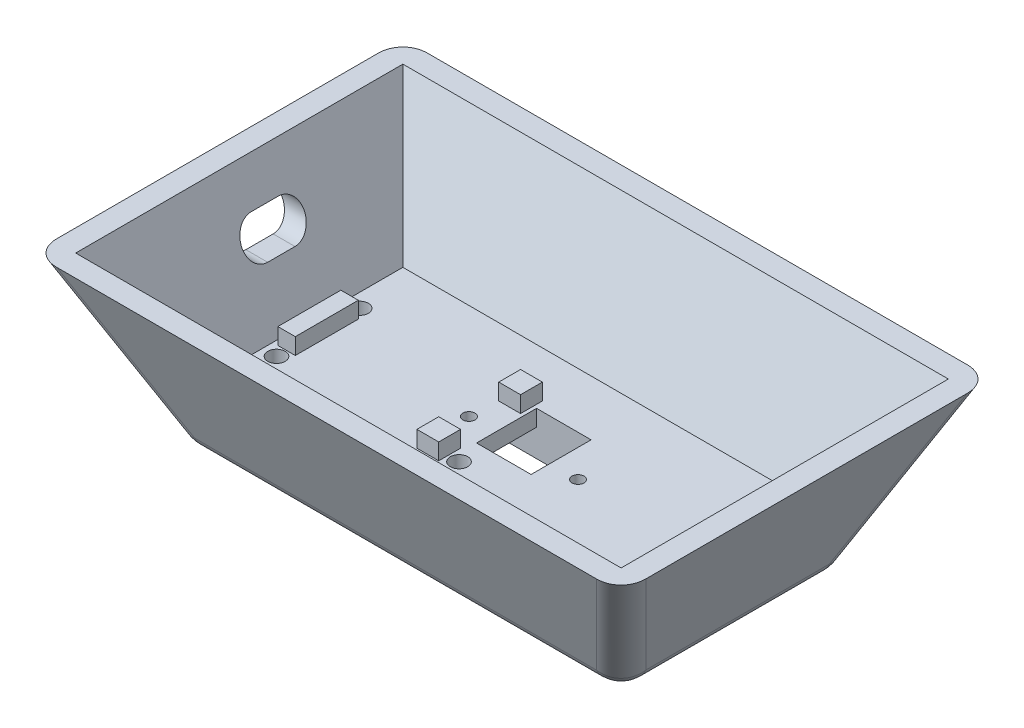
from build123d import *

# Parameters (mm, degrees)
SKETCH1_W                = 80
SKETCH1_H                = 40
BOSS_EXTRUDE1_DEPTH      = 30
BOSS_EXTRUDE1_DRAFT      = -25
SKETCH2_W                = 30.2
SKETCH2_H                = 19.2
CUT_EXTRUDE1_DEPTH       = 5
SKETCH3_W                = 99.97845949
SKETCH3_H                = 59.97845949
CUT_EXTRUDE3_DEPTH       = 22
CUT_EXTRUDE3_DRAFT       = -25
CUT_EXTRUDE4_REACH       = 70.521
SKETCH5_R                = 1.1
SKETCH5_W                = 10
SKETCH5_H                = 11
SKETCH6_R                = 1.6
PCB_HEATSETINSERTS_DEPTH = 4.75
SKETCH7_W                = 4
SKETCH7_H                = 4
SKETCH7_W_2              = 3.2
SKETCH7_H_2              = 11.55
BOSS_EXTRUDE3_DEPTH      = 3
FILLET1_R                = 5
USB_C_CUTOUT_REACH       = 102.398


with BuildPart() as part:
    # Sketch1 → Boss-Extrude1 (with draft: the straight prism first)
    with BuildSketch(Plane(origin=(0, 0, 0), x_dir=(1, 0, 0), z_dir=(0, 1, 0))):
        Rectangle(SKETCH1_W, SKETCH1_H)
    extrude(amount=BOSS_EXTRUDE1_DEPTH)
    # Boss-Extrude1: the draft: its side faces are tilted about the plane it starts from
    boss_extrude1_sides = [part.faces().sort_by_distance(p)[0] for p in [
        (-40, 15, 0),
        (0, 15, 20),
        (40, 15, 0),
        (0, 15, -20),
    ]]
    draft(boss_extrude1_sides, Plane(origin=(0, 0, 0), x_dir=(1, 0, 0), z_dir=(0, 1, 0)), BOSS_EXTRUDE1_DRAFT)

    # Sketch2 → Cut-Extrude1 (cut)
    with BuildSketch(Plane.XZ):
        Rectangle(SKETCH2_W, SKETCH2_H)
    extrude(amount=-CUT_EXTRUDE1_DEPTH, mode=Mode.SUBTRACT)


with BuildPart() as cut_extrude3_tool:
    # Sketch3 → Cut-Extrude3 (with draft: the straight prism first)
    with BuildSketch(Plane(origin=(0, 30, 0), x_dir=(1, 0, 0), z_dir=(0, 1, 0))):
        Rectangle(SKETCH3_W, SKETCH3_H)
    extrude(amount=-CUT_EXTRUDE3_DEPTH)
    # Cut-Extrude3: the draft: its side faces are tilted about the plane it starts from
    cut_extrude3_sides = [cut_extrude3_tool.faces().sort_by_distance(p)[0] for p in [
        (-49.989229745, 19, 0),
        (0, 19, 29.989229745),
        (49.989229745, 19, 0),
        (0, 19, -29.989229745),
    ]]
    draft(cut_extrude3_sides, Plane(origin=(0, 30, 0), x_dir=(1, 0, 0), z_dir=(0, 1, 0)), CUT_EXTRUDE3_DRAFT)


with BuildPart() as part_1:
    add(part.part)

    # Cut-Extrude3: cut by cut_extrude3_tool
    add(cut_extrude3_tool.part, mode=Mode.SUBTRACT)

    # Sketch5 → Cut-Extrude4 (cut, up to next)
    with BuildSketch(Plane.XZ.offset(-5), mode=Mode.PRIVATE) as cut_extrude4_sk1:
        with Locations(Location((-10, -2.1, 0), (0, 0, 270))):
            Circle(SKETCH5_R)
    cut_extrude4_tool1 = extrude(cut_extrude4_sk1.sketch, amount=-CUT_EXTRUDE4_REACH, mode=Mode.PRIVATE) & part_1.part
    # Sketch5 → Cut-Extrude4 (cut, up to next)
    with BuildSketch(Plane.XZ.offset(-5), mode=Mode.PRIVATE) as cut_extrude4_sk2:
        with Locations(Location((10, -2.1, 0), (0, 0, 270))):
            Circle(SKETCH5_R)
    cut_extrude4_tool2 = extrude(cut_extrude4_sk2.sketch, amount=-CUT_EXTRUDE4_REACH, mode=Mode.PRIVATE) & part_1.part
    # Sketch5 → Cut-Extrude4 (cut, up to next)
    with BuildSketch(Plane.XZ.offset(-5), mode=Mode.PRIVATE) as cut_extrude4_sk3:
        with Locations((-0.1, -4.1)):
            Rectangle(SKETCH5_W, SKETCH5_H)
    cut_extrude4_tool3 = extrude(cut_extrude4_sk3.sketch, amount=-CUT_EXTRUDE4_REACH, mode=Mode.PRIVATE) & part_1.part
    add(cut_extrude4_tool1.solids().sort_by_distance((-10, 5, -2.1))[0], mode=Mode.SUBTRACT)
    add(cut_extrude4_tool2.solids().sort_by_distance((10, 5, -2.1))[0], mode=Mode.SUBTRACT)
    add(cut_extrude4_tool3.solids().sort_by_distance((-0.1, 5, -4.1))[0], mode=Mode.SUBTRACT)

    # Sketch6 → PCB_HeatSetInserts (cut)
    with BuildSketch(Plane(origin=(0, 8, 0), x_dir=(1, 0, 0), z_dir=(0, 1, 0))):
        with Locations(Location((-37.190461265, -5.98, 0), (0, 0, 270))):
            Circle(SKETCH6_R)
        with Locations(Location((-37.190461265, 9.27, 0), (0, 0, 270))):
            Circle(SKETCH6_R)
        with Locations(Location((-3.730461265, -5.98, 0), (0, 0, 270))):
            Circle(SKETCH6_R)
    extrude(amount=-PCB_HEATSETINSERTS_DEPTH, mode=Mode.SUBTRACT)

    # Sketch7 → Boss-Extrude3 (add)
    with BuildSketch(Plane(origin=(0, 8, 0), x_dir=(1, 0, 0), z_dir=(0, 1, 0))):
        with Locations((-7.730461265, -5.7)):
            Rectangle(SKETCH7_W, SKETCH7_H)
        with Locations((-37.190461265, 1.645)):
            Rectangle(SKETCH7_W_2, SKETCH7_H_2)
        with Locations((-7.730461265, 9.3)):
            Rectangle(SKETCH7_W, SKETCH7_H)
    extrude(amount=BOSS_EXTRUDE3_DEPTH)

    # Fillet1
    fillet1_edges = [part_1.edges().sort_by_distance(p)[0] for p in [
        (0, 0, 20),
        (-40, 0, 0),
        (0, 0, -20),
        (40, 0, 0),
        (46.994614872, 15, 26.994614872),
        (-46.994614872, 15, 26.994614872),
        (-46.994614872, 15, -26.994614872),
        (46.994614872, 15, -26.994614872),
    ]]
    fillet(fillet1_edges, radius=FILLET1_R)

    # USB-C Cutout: up to this plane
    usb_c_cutout_end = Plane(origin=(-40, 0, -20), z_dir=(-0.9063077870366496, -0.4226182617407003, 0))
    # Sketch10 → USB-C Cutout (cut, up to the surface)
    with BuildSketch(Plane(origin=(-35.590461265, 0, 0), x_dir=(0, 0, -1), z_dir=(1, 0, 0)), mode=Mode.PRIVATE) as usb_c_cutout_sk1:
        with BuildLine():
            Line((-0.855, 23.5), (4.145, 23.5))
            ThreePointArc((4.145, 23.5), (7.395, 20.25), (4.145, 17))
            Line((4.145, 17), (-0.855, 17))
            ThreePointArc((-0.855, 17), (-4.105, 20.25), (-0.855, 23.5))
        make_face()
    usb_c_cutout_tool1 = split(extrude(usb_c_cutout_sk1.sketch, amount=-USB_C_CUTOUT_REACH, mode=Mode.PRIVATE), bisect_by=usb_c_cutout_end, keep=Keep.BOTH, mode=Mode.PRIVATE)
    add(usb_c_cutout_tool1.solids().sort_by_distance((-35.590461, 20.25, -1.645))[0], mode=Mode.SUBTRACT)


solid = part_1.part
